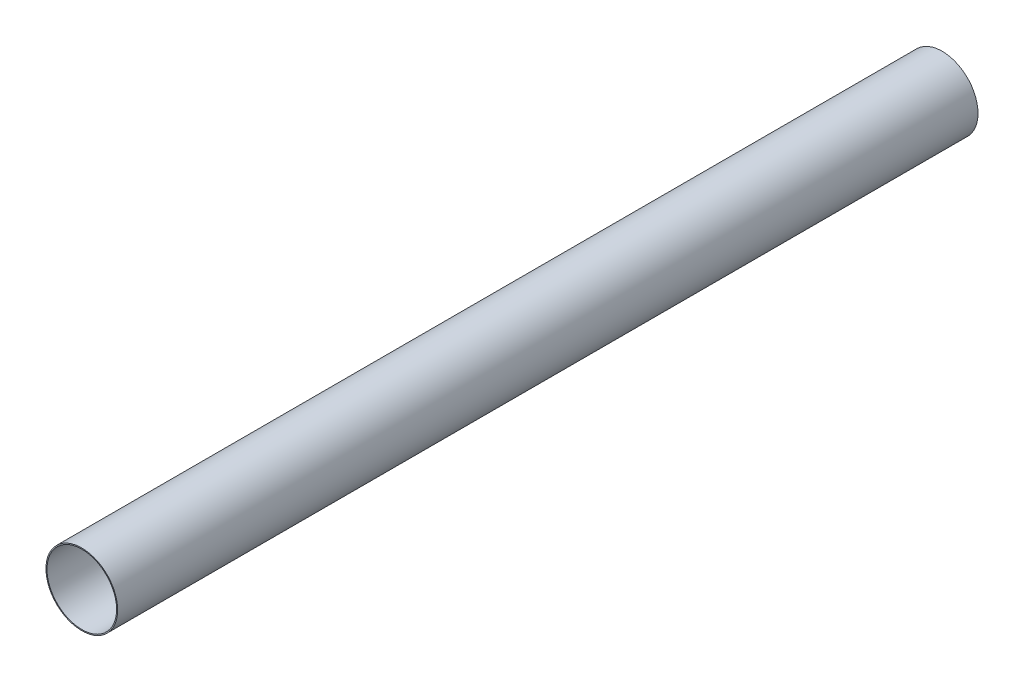
from build123d import *

# Parameters (mm, degrees)
SKETCH1_R           = 69.85
SKETCH1_R_2         = 67.85
BOSS_EXTRUDE1_DEPTH = 1676.4


with BuildPart() as part:
    # Sketch1 → Boss-Extrude1 (new body)
    with BuildSketch(Plane.XY):
        Circle(SKETCH1_R)
        Circle(SKETCH1_R_2, mode=Mode.SUBTRACT)
    extrude(amount=BOSS_EXTRUDE1_DEPTH)


solid = part.part
